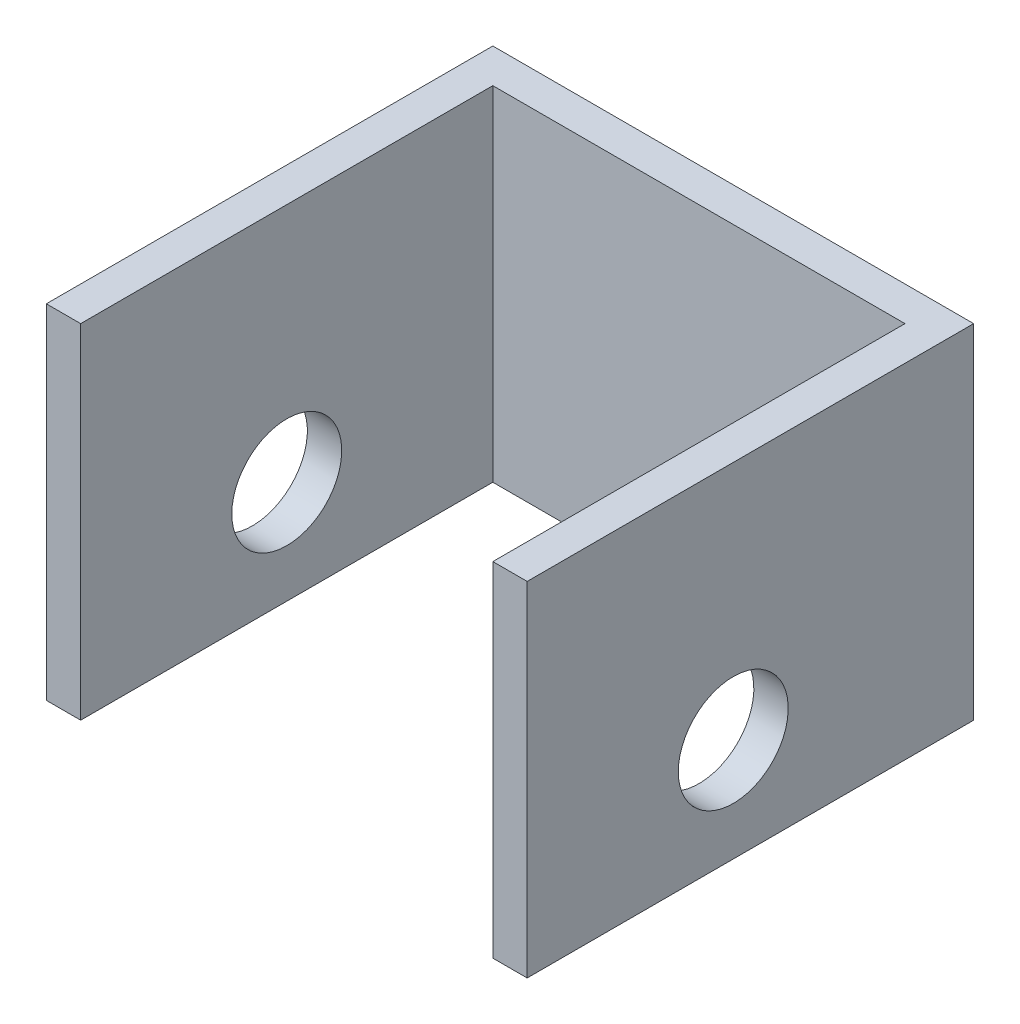
from build123d import *

# Parameters (mm, degrees)
ESQUISSE1_W             = 70
ESQUISSE1_H             = 50
BOSS_EXTRU_1_DEPTH      = 5
ESQUISSE2_W             = 5
ESQUISSE2_H             = 50
BOSS_EXTRU_2_DEPTH      = 60
ESQUISSE3_R             = 8
ENL_V_MAT_EXTRU_1_DEPTH = 108.819293264


with BuildPart() as part:
    # Esquisse1 → Boss.-Extru.1 (new body)
    with BuildSketch(Plane.XY):
        with Locations((35, 25)):
            Rectangle(ESQUISSE1_W, ESQUISSE1_H)
    extrude(amount=BOSS_EXTRU_1_DEPTH)

    # Esquisse2 → Boss.-Extru.2 (add)
    with BuildSketch(Plane.XY.offset(5)):
        with Locations((2.5, 25)):
            Rectangle(ESQUISSE2_W, ESQUISSE2_H)
        with Locations((67.5, 25)):
            Rectangle(ESQUISSE2_W, ESQUISSE2_H)
    extrude(amount=BOSS_EXTRU_2_DEPTH)

    # Esquisse3 → Enlèv. mat.-Extru.1 (cut, through all)
    with BuildSketch(Plane.ZY):
        with Locations((35, 15)):
            Circle(ESQUISSE3_R)
    extrude(amount=-ENL_V_MAT_EXTRU_1_DEPTH, mode=Mode.SUBTRACT)


solid = part.part
